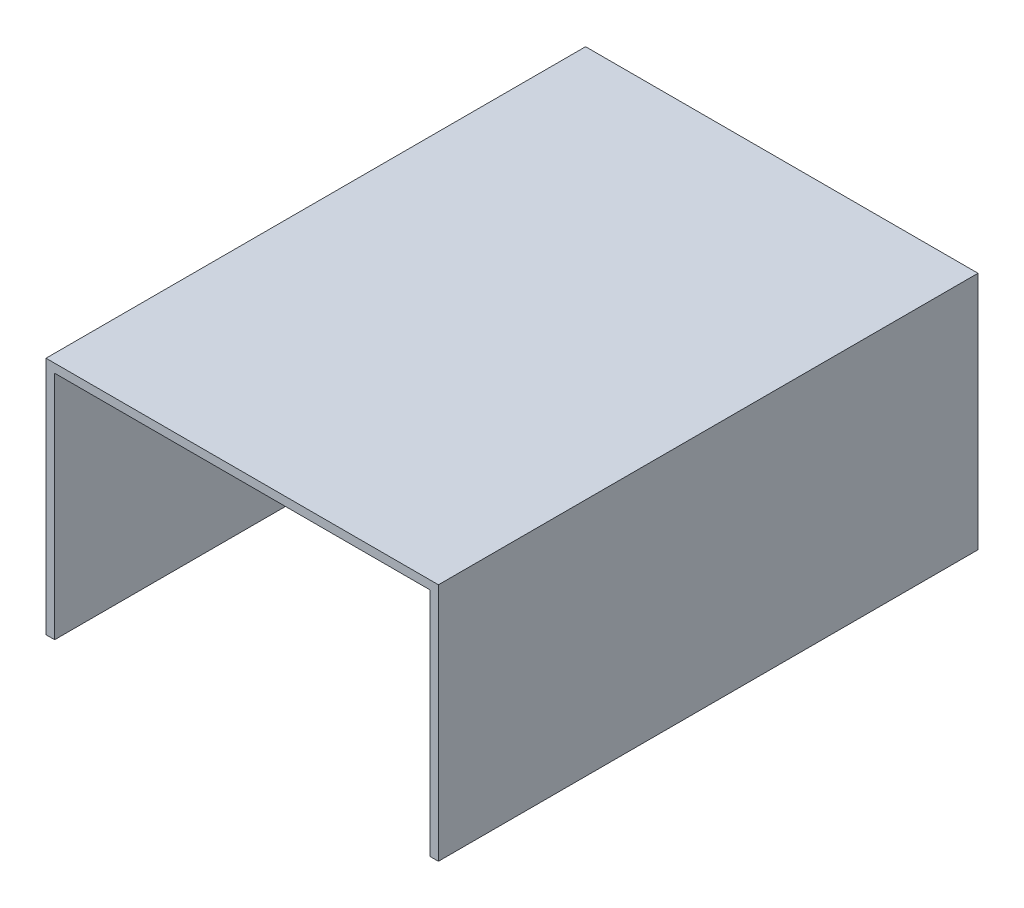
from build123d import *

# Parameters (mm, degrees)
ESBO_O1_W                  = 13.6
ESBO_O1_H                  = 8.3
RESSALTO_EXTRUS_O1_DEPTH   = 18.7
CORTE_EXTRUS_O1_DEPTH      = 21.326153104
CORTE_EXTRUS_O1_DEPTH_BACK = 18.1
ESBO_O4_W                  = 13
ESBO_O4_H                  = 8
CORTE_EXTRUS_O2_REACH      = 22.326
ESBO_O5_R                  = 1.4


with BuildPart() as part:
    # Esboço1 → Ressalto-extrusão1 (new body)
    with BuildSketch(Plane.XY):
        Rectangle(ESBO_O1_W, ESBO_O1_H)
    extrude(amount=RESSALTO_EXTRUS_O1_DEPTH)

    # Esboço4 → Corte-extrusão1 (cut, two sides: drawn at the far end of the back side and taken through both)
    with BuildSketch(Plane.XY.offset(18.7).offset(-CORTE_EXTRUS_O1_DEPTH_BACK)):
        with Locations((0, -0.15)):
            Rectangle(ESBO_O4_W, ESBO_O4_H)
    extrude(amount=CORTE_EXTRUS_O1_DEPTH + CORTE_EXTRUS_O1_DEPTH_BACK, mode=Mode.SUBTRACT)

    # Esboço5 → Corte-extrusão2 (cut, up to next)
    with BuildSketch(Plane(origin=(0, 0, 0), x_dir=(-1, 0, 0), z_dir=(0, 0, -1)), mode=Mode.PRIVATE) as corte_extrus_o2_sk1:
        Circle(ESBO_O5_R)
    corte_extrus_o2_tool1 = extrude(corte_extrus_o2_sk1.sketch, amount=-CORTE_EXTRUS_O2_REACH, mode=Mode.PRIVATE) & part.part
    add(corte_extrus_o2_tool1.solids().sort_by_distance((0, 0, 0))[0], mode=Mode.SUBTRACT)


solid = part.part
